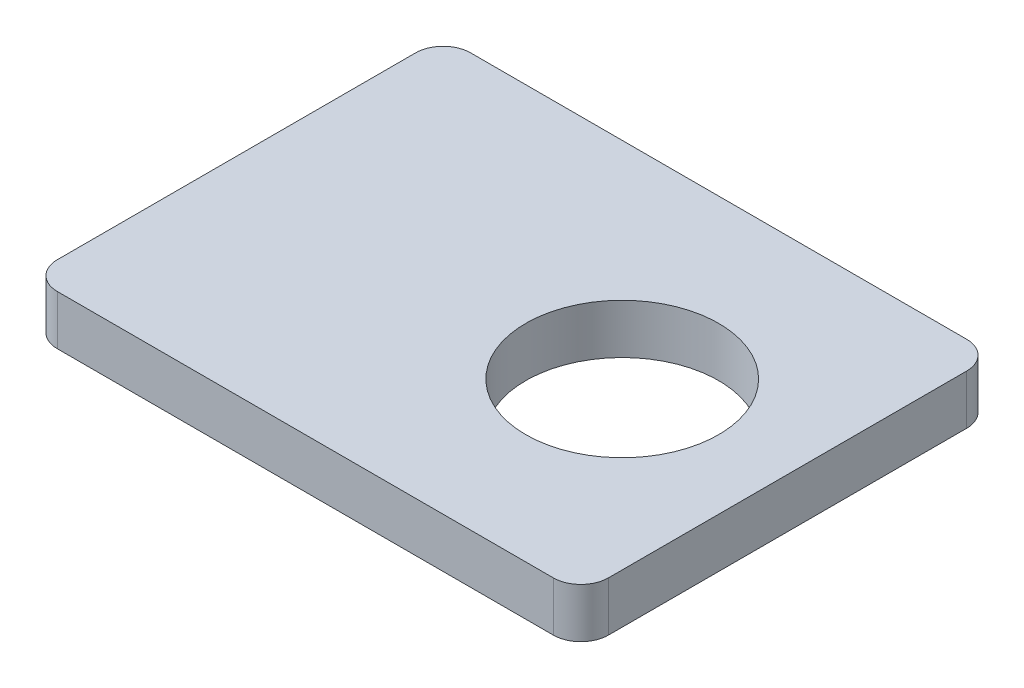
from build123d import *

# Parameters (mm, degrees)
SKETCH_1_W      = 200
SKETCH_1_H      = 150
SKETCH_1_R      = 35
EXTRUDE_1_DEPTH = 18
FILLET_1_R      = 10


with BuildPart() as part:
    # 草图1 → 凸台-拉伸1 (new body)
    with BuildSketch(Plane(origin=(0, 0, 0), x_dir=(1, 0, 0), z_dir=(0, 1, 0))):
        Rectangle(SKETCH_1_W, SKETCH_1_H)
        with Locations(Location((40, 0, 0), (0, 0, 270))):
            Circle(SKETCH_1_R, mode=Mode.SUBTRACT)
    extrude(amount=EXTRUDE_1_DEPTH)

    # 圆角1
    fillet_1_edges = [part.edges().sort_by_distance(p)[0] for p in [
        (-100, 9, -75),
        (100, 9, -75),
        (100, 9, 75),
        (-100, 9, 75),
    ]]
    fillet(fillet_1_edges, radius=FILLET_1_R)


solid = part.part
